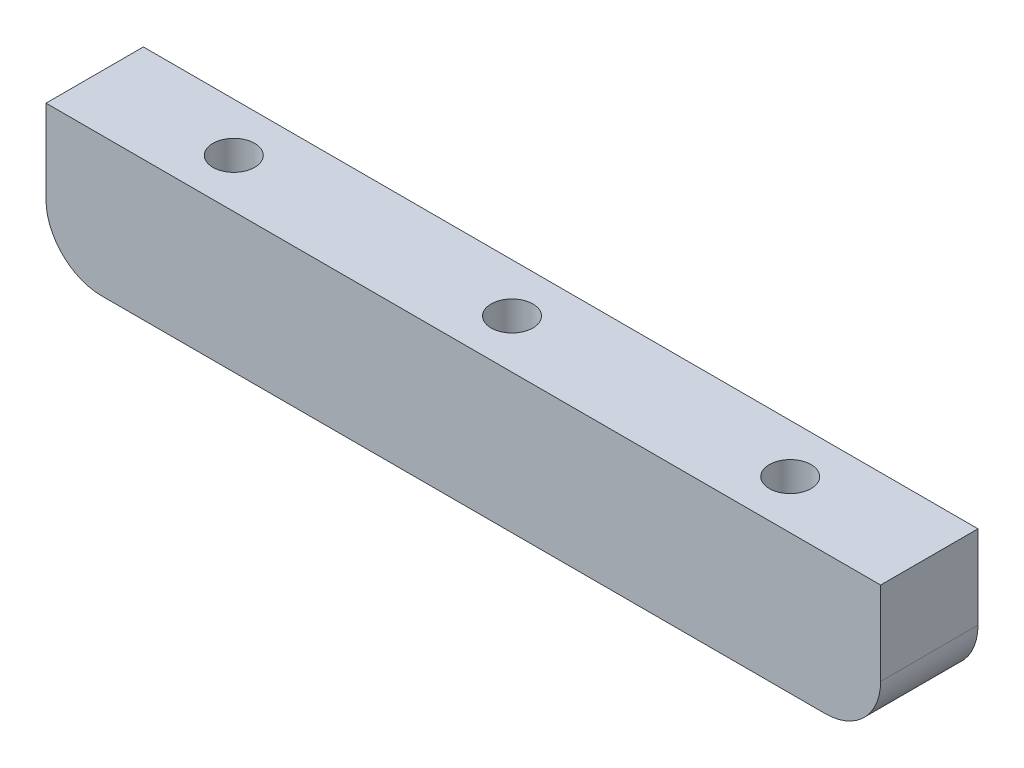
from build123d import *

# Parameters (mm, degrees)
SKETCH1_W           = 60
SKETCH1_H           = 7
BOSS_EXTRUDE1_DEPTH = 10
SKETCH2_R           = 1.5
CUT_EXTRUDE1_DEPTH  = 5
FILLET1_R           = 4


with BuildPart() as part:
    # Sketch1 → Boss-Extrude1 (new body)
    with BuildSketch(Plane(origin=(0, 0, 0), x_dir=(1, 0, 0), z_dir=(0, 1, 0))):
        Rectangle(SKETCH1_W, SKETCH1_H)
    extrude(amount=BOSS_EXTRUDE1_DEPTH)

    # Sketch2 → Cut-Extrude1 (cut)
    with BuildSketch(Plane(origin=(0, 10, 0), x_dir=(1, 0, 0), z_dir=(0, 1, 0))):
        with Locations(Location((0, 0, 0), (0, 0, 270))):
            Circle(SKETCH2_R)
        with Locations(Location((20, 0, 0), (0, 0, 270))):
            Circle(SKETCH2_R)
        with Locations(Location((-20, 0, 0), (0, 0, 270))):
            Circle(SKETCH2_R)
    extrude(amount=-CUT_EXTRUDE1_DEPTH, mode=Mode.SUBTRACT)

    # Fillet1
    fillet1_edges = [part.edges().sort_by_distance(p)[0] for p in [
        (-30, 0, 0),
        (30, 0, 0),
    ]]
    fillet(fillet1_edges, radius=FILLET1_R)


solid = part.part
